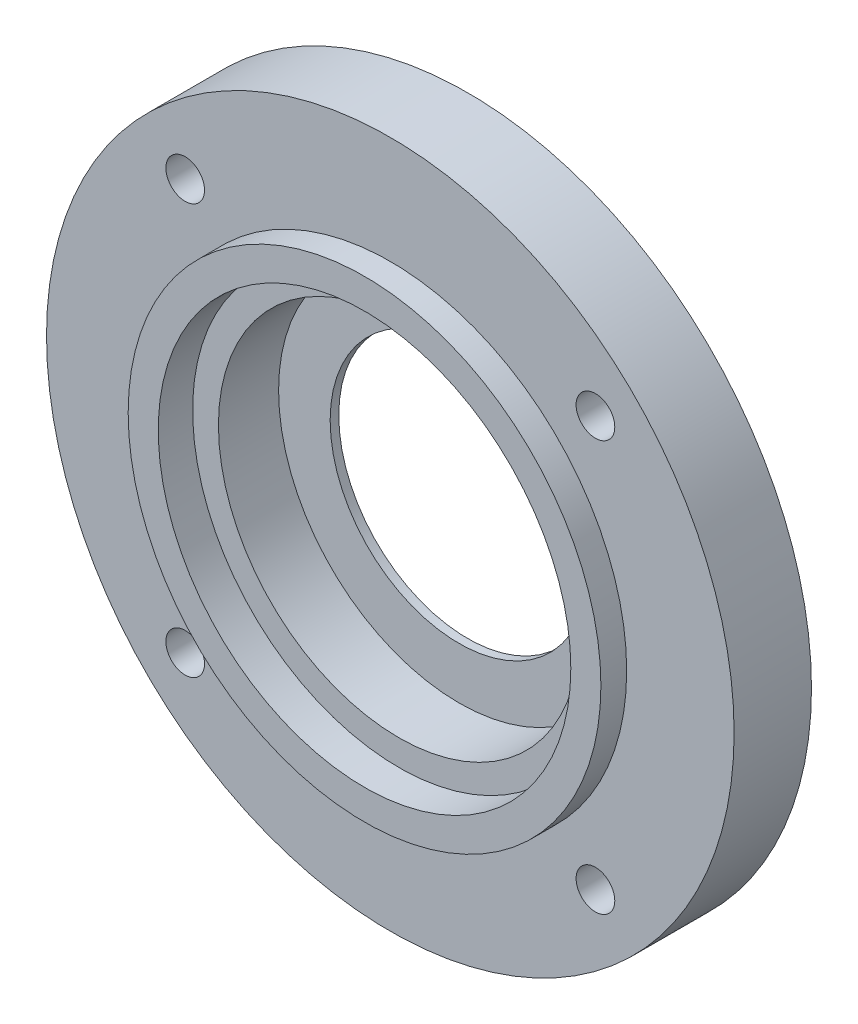
from build123d import *

# Parameters (mm, degrees)
SKETCH4_R                = 2.25
CUT_4XD4_5_PCD67_5_DEPTH = 150


with BuildPart() as part:
    # Sketch3 → REV_Seal_Cover_28x42x7 (revolve)
    with BuildSketch(Plane(origin=(0, 0, 0), x_dir=(1, 0, 0), z_dir=(0, 1, 0))):
        Polygon((15, 105), (40, 105), (40, 96), (27.5, 96), (27.5, 93), (24, 93), (24, 97), (21, 97), (21, 104), (15, 104), align=None)
    revolve(axis=Axis((0, 0, 150), (0, 0, -1)))

    # Sketch4 → CUT_4xD4.5_PCD67.5 (cut, symmetric)
    with BuildSketch(Plane.XY):
        with Locations(Location((23.8649, 23.8649, 0), (0, 0, 180))):
            Circle(SKETCH4_R)
        with Locations(Location((-23.8649, 23.8649, 0), (0, 0, 180))):
            Circle(SKETCH4_R)
        with Locations(Location((-23.8649, -23.8649, 0), (0, 0, 180))):
            Circle(SKETCH4_R)
        with Locations(Location((23.8649, -23.8649, 0), (0, 0, 180))):
            Circle(SKETCH4_R)
    extrude(amount=CUT_4XD4_5_PCD67_5_DEPTH, both=True, mode=Mode.SUBTRACT)


solid = part.part
